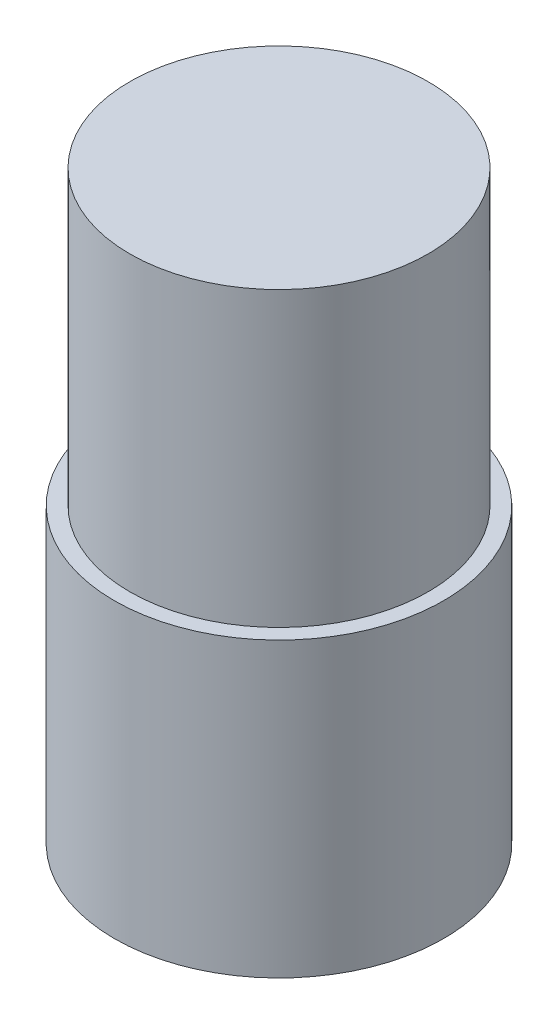
from build123d import *

# Parameters (mm, degrees)
SKETCH1_R           = 7.14375
BOSS_EXTRUDE1_DEPTH = 25.4
SKETCH2_R           = 7.836157222
SKETCH2_R_2         = 6.475
CUT_EXTRUDE1_DEPTH  = 12.7


with BuildPart() as part:
    # Sketch1 → Boss-Extrude1 (new body)
    with BuildSketch(Plane(origin=(0, 0, 0), x_dir=(1, 0, 0), z_dir=(0, 1, 0))):
        with Locations(Location((0, 0, 0), (0, 0, 270))):
            Circle(SKETCH1_R)
    extrude(amount=BOSS_EXTRUDE1_DEPTH)

    # Sketch2 → Cut-Extrude1 (cut)
    with BuildSketch(Plane(origin=(0, 25.4, 0), x_dir=(1, 0, 0), z_dir=(0, 1, 0))):
        Circle(SKETCH2_R)
        with Locations(Location((0, 0, 0), (0, 0, 270))):
            Circle(SKETCH2_R_2, mode=Mode.SUBTRACT)
    extrude(amount=-CUT_EXTRUDE1_DEPTH, mode=Mode.SUBTRACT)


solid = part.part
